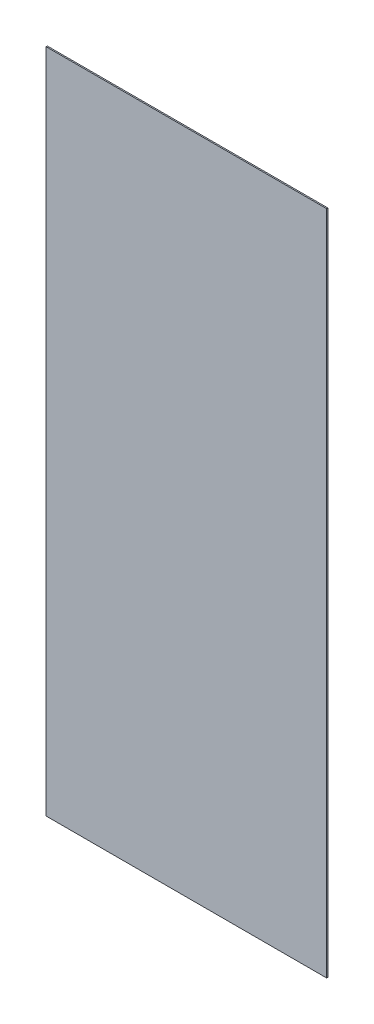
from build123d import *

# Parameters (mm, degrees)
SKETCH_1_W      = 203.2
SKETCH_1_H      = 482.6
EXTRUDE_1_DEPTH = 0.9


with BuildPart() as part:
    # 草图1 → 凸台-拉伸1 (new body)
    with BuildSketch(Plane.XY):
        Rectangle(SKETCH_1_W, SKETCH_1_H)
    extrude(amount=EXTRUDE_1_DEPTH)


solid = part.part
